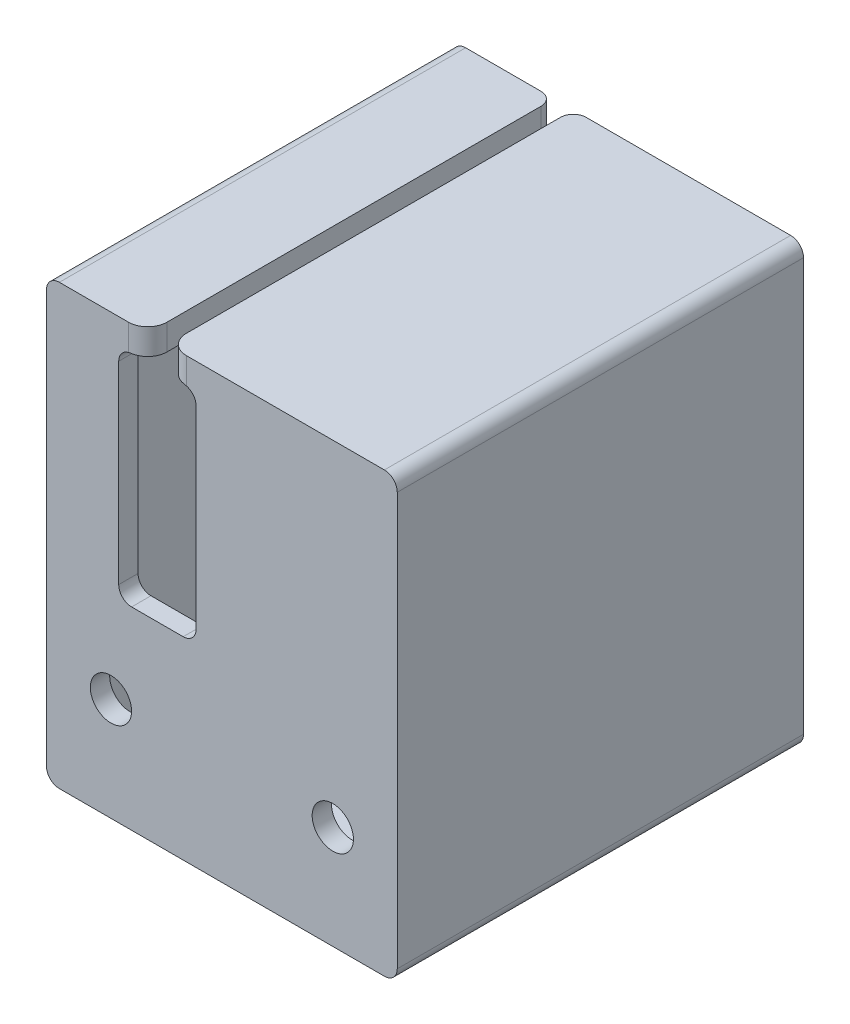
from build123d import *

# Parameters (mm, degrees)
SKETCH1_W           = 27.2
SKETCH1_H           = 34
SKETCH1_W_2         = 23.2
SKETCH1_H_2         = 30
BOSS_EXTRUDE1_DEPTH = 30
SKETCH2_W           = 27.2
SKETCH2_H           = 34
BOSS_EXTRUDE2_DEPTH = 1.5
SKETCH3_W           = 6
SKETCH3_H           = 17
SKETCH3_R           = 1.6
CUT_EXTRUDE1_DEPTH  = 31.5
FILLET1_R           = 1
SKETCH4_W           = 1.5
SKETCH4_H           = 2
CUT_EXTRUDE2_DEPTH  = 31.5
FILLET2_R           = 1
FILLET3_R           = 1.5


with BuildPart() as part:
    # Sketch1 → Boss-Extrude1 (new body)
    with BuildSketch(Plane.XY):
        Rectangle(SKETCH1_W, SKETCH1_H)
        Rectangle(SKETCH1_W_2, SKETCH1_H_2, mode=Mode.SUBTRACT)
    extrude(amount=BOSS_EXTRUDE1_DEPTH)

    # Sketch2 → Boss-Extrude2 (add)
    with BuildSketch(Plane.XY.offset(30)):
        Rectangle(SKETCH2_W, SKETCH2_H)
    extrude(amount=BOSS_EXTRUDE2_DEPTH)

    # Sketch3 → Cut-Extrude1 (cut)
    with BuildSketch(Plane.XY.offset(31.5)):
        with Locations((-5, 6.5)):
            Rectangle(SKETCH3_W, SKETCH3_H)
        with Locations((-8.6, -9)):
            Circle(SKETCH3_R)
        with Locations((8.6, -9)):
            Circle(SKETCH3_R)
    extrude(amount=-CUT_EXTRUDE1_DEPTH, mode=Mode.SUBTRACT)

    # Fillet1
    fillet1_edges = [part.edges().sort_by_distance(p)[0] for p in [
        (-8, -2, 30.75),
        (-2, -2, 30.75),
        (-2, 15, 30.75),
        (-8, 15, 30.75),
        (-13.6, 17, 15.75),
        (13.6, 17, 15.75),
        (13.6, -17, 15.75),
        (-13.6, -17, 15.75),
    ]]
    fillet(fillet1_edges, radius=FILLET1_R)

    # Sketch4 → Cut-Extrude2 (cut)
    with BuildSketch(Plane.XY.offset(31.5)):
        with Locations((-5, 16)):
            Rectangle(SKETCH4_W, SKETCH4_H)
    extrude(amount=-CUT_EXTRUDE2_DEPTH, mode=Mode.SUBTRACT)

    # Fillet2
    fillet2_edges = [part.edges().sort_by_distance(p)[0] for p in [
        (-4.25, 16, 0),
        (-5.75, 16, 0),
    ]]
    fillet(fillet2_edges, radius=FILLET2_R)

    # Fillet3
    fillet3_edges = [part.edges().sort_by_distance(p)[0] for p in [
        (-5.75, 16, 31.5),
        (-4.25, 16, 31.5),
    ]]
    fillet(fillet3_edges, radius=FILLET3_R)


solid = part.part
